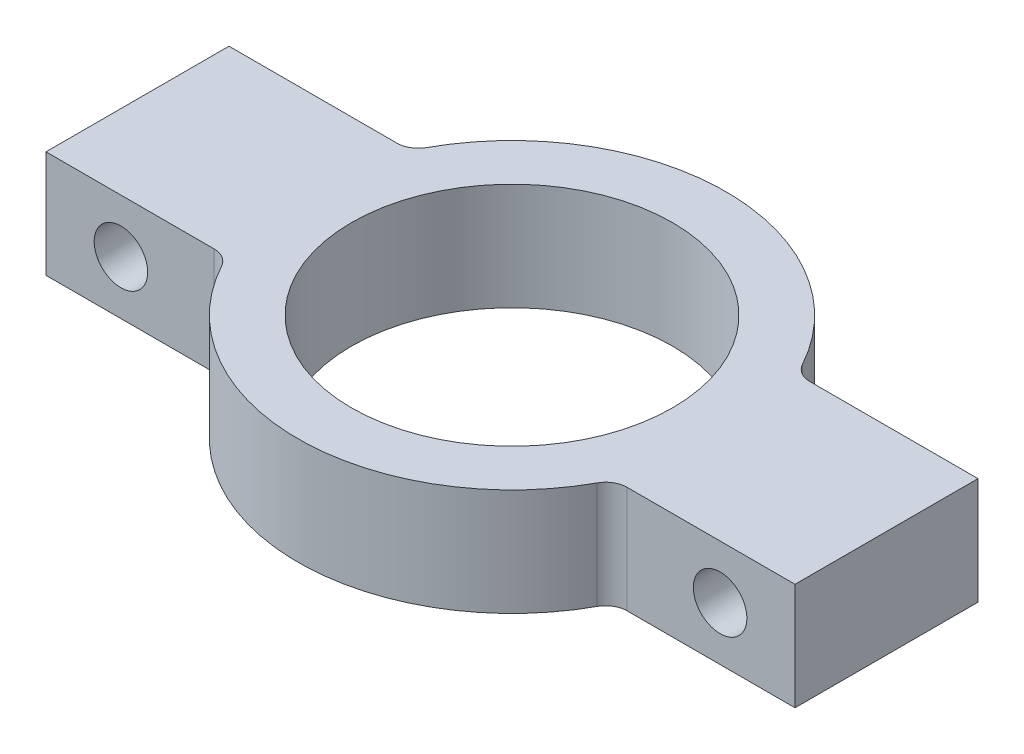
from build123d import *

# Parameters (mm, degrees)
EXTRUDE_1_DEPTH     = 2.5
SKETCH_2_R          = 1.250000000000001
SKETCH_2_R_2        = 1.2499999999999991
CUT_EXTRUDE_1_DEPTH = 10
FILLET_1_R          = 1


with BuildPart() as part:
    # ｽｹｯﾁ1 → ﾎﾞｽ - 押し出し1 (new, symmetric)
    with BuildSketch(Plane(origin=(0, 0, 0), x_dir=(1, 0, 0), z_dir=(0, 1, 0))):
        with BuildLine():
            Line((-9.040153483210384, 4.275000000000001), (-17.500000000000004, 4.275000000000001))
            Line((-17.500000000000004, 4.275000000000001), (-17.5, -4.2749999999999995))
            Line((-17.5, -4.2749999999999995), (-9.040153483210384, -4.2749999999999995))
            ThreePointArc((-9.040153483210364, -4.2749999999999355), (-9.999999999999996, 2.09e-15), (-9.040153483210364, 4.27499999999994))
        make_face()
        with BuildLine():
            Line((-6.162335190493877, 4.275), (-9.040153483210384, 4.275000000000001))
            ThreePointArc((-9.040153483210364, 4.27499999999994), (-9.999999999999996, 2.09e-15), (-9.040153483210364, -4.2749999999999355))
            Line((-9.040153483210384, -4.2749999999999995), (-6.162335190493877, -4.2749999999999995))
            ThreePointArc((-6.162335190493898, -4.275000000000058), (-7.499999999999997, 1.79e-15), (-6.1623351904938986, 4.275000000000059))
        make_face()
        with BuildLine():
            ThreePointArc((10.000000000000004, 8.7e-16), (9.757088060279663, 2.1907150850688284), (9.040153483210378, 4.2749999999999195))
            Line((9.040153483210407, 4.2749999999999995), (6.162335190493945, 4.275))
            ThreePointArc((6.162335190493945, 4.275000000000002), (7.15777597891638, 2.2396970856898766), (7.500000000000004, 8.7e-16))
            ThreePointArc((7.500000000000004, -9.7e-16), (7.157775978916378, -2.2396970856898806), (6.162335190493939, -4.275000000000008))
            Line((6.162335190493941, -4.275), (9.04015348321041, -4.275))
            ThreePointArc((9.04015348321038, -4.274999999999914), (9.757088060279663, -2.190715085068826), (10.000000000000004, -1.58e-15))
        make_face()
        with BuildLine():
            ThreePointArc((9.040153483210378, 4.2749999999999195), (1.296e-14, 10), (-9.040153483210364, 4.27499999999994))
            Line((-9.040153483210384, 4.275000000000001), (-6.162335190493877, 4.275))
            ThreePointArc((-6.1623351904938986, 4.275000000000059), (3.724e-14, 7.500000000000002), (6.162335190493945, 4.275000000000002))
            Line((6.162335190493945, 4.275), (9.040153483210407, 4.2749999999999995))
        make_face()
        with BuildLine():
            Line((17.499999999999996, 4.2749999999999995), (9.040153483210407, 4.2749999999999995))
            ThreePointArc((9.040153483210378, 4.2749999999999195), (9.757088060279663, 2.1907150850688284), (10.000000000000004, 8.7e-16))
            ThreePointArc((10.000000000000004, -1.58e-15), (9.757088060279663, -2.190715085068826), (9.04015348321038, -4.274999999999914))
            Line((9.04015348321041, -4.275), (17.5, -4.275))
            Line((17.5, -4.275000000000001), (17.499999999999996, 4.2749999999999995))
        make_face()
        with BuildLine():
            Line((-6.162335190493877, -4.2749999999999995), (-9.040153483210384, -4.2749999999999995))
            ThreePointArc((-9.040153483210364, -4.2749999999999355), (1.94e-14, -10), (9.04015348321038, -4.274999999999914))
            Line((9.04015348321041, -4.275), (6.162335190493941, -4.275))
            ThreePointArc((6.162335190493939, -4.275000000000008), (3.54e-14, -7.5), (-6.162335190493898, -4.275000000000058))
        make_face()
    extrude(amount=EXTRUDE_1_DEPTH, both=True)

    # ｽｹｯﾁ2 → ｶｯﾄ - 押し出し1 (cut)
    with BuildSketch(Plane(origin=(2.1e-16, 0, -4.275), x_dir=(-1, 0, -5e-17), z_dir=(5e-17, 0, -1))):
        with Locations((14, 0)):
            Circle(SKETCH_2_R)
        with Locations((-14, 0)):
            Circle(SKETCH_2_R_2)
    extrude(amount=-CUT_EXTRUDE_1_DEPTH, mode=Mode.SUBTRACT)

    # ﾌｨﾚｯﾄ1
    fillet_1_edges = [part.edges().sort_by_distance(p)[0] for p in [
        (-9.040153483210375, 0, 4.274999999999968),
        (-9.040153483210375, 0, -4.27499999999997),
        (9.040153483210393, 0, -4.2749999999999595),
        (9.040153483210396, 0, 4.274999999999958),
    ]]
    fillet(fillet_1_edges, radius=FILLET_1_R)


solid = part.part
